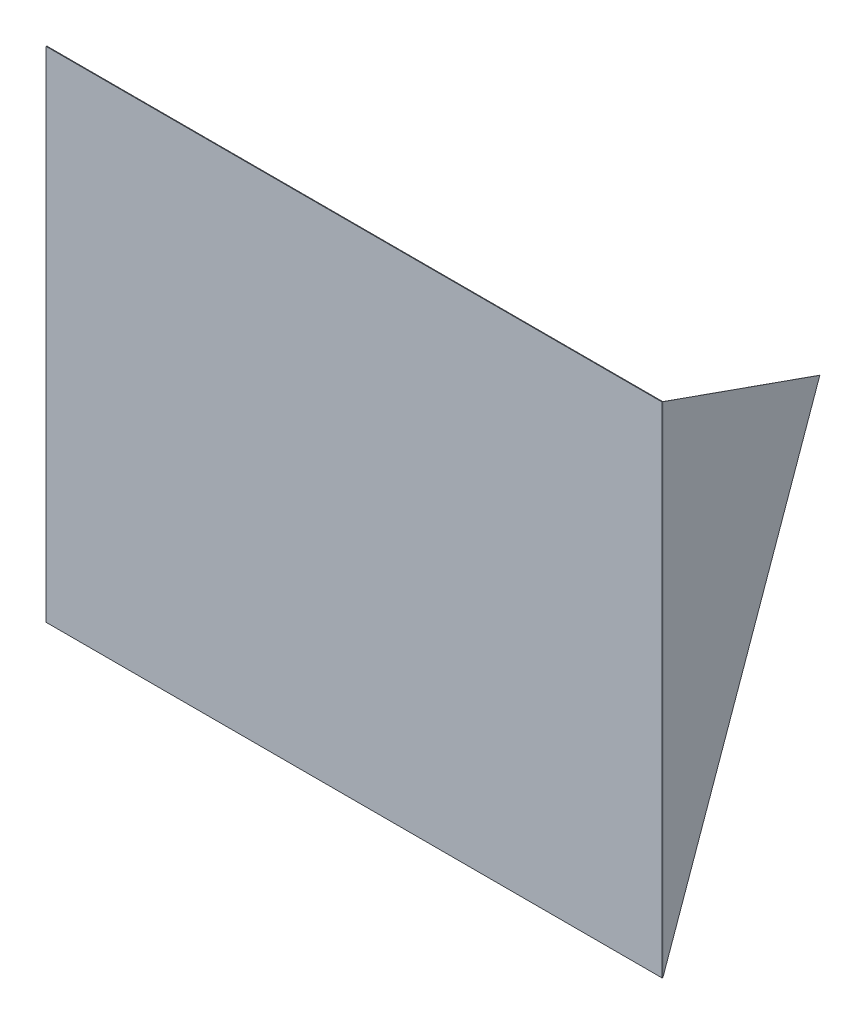
from build123d import *

# Parameters (mm, degrees)
SKETCH_1_W      = 9200
SKETCH_1_H      = 7450
EXTRUDE_1_DEPTH = 10
EXTRUDE_2_DEPTH = 1


with BuildPart() as part:
    # Эскиз1 → Бобышка-Вытянуть1 (new body)
    with BuildSketch(Plane.XY):
        with Locations((-3108.022618245, -1035.961292375)):
            Rectangle(SKETCH_1_W, SKETCH_1_H)
    extrude(amount=EXTRUDE_1_DEPTH)


with BuildPart() as body_2:
    # Эскиз2 → Бобышка-Вытянуть2 (new body)
    with BuildSketch(Plane(origin=(1491.977381755, 0, 0), x_dir=(0, 0, -1), z_dir=(1, 0, 0))):
        Polygon((0, -4760.961292375), (2344.218456661, 1858.907414052), (0, 2689.038707625), align=None)
    extrude(amount=EXTRUDE_2_DEPTH)


solid = Compound([part.part, body_2.part])
